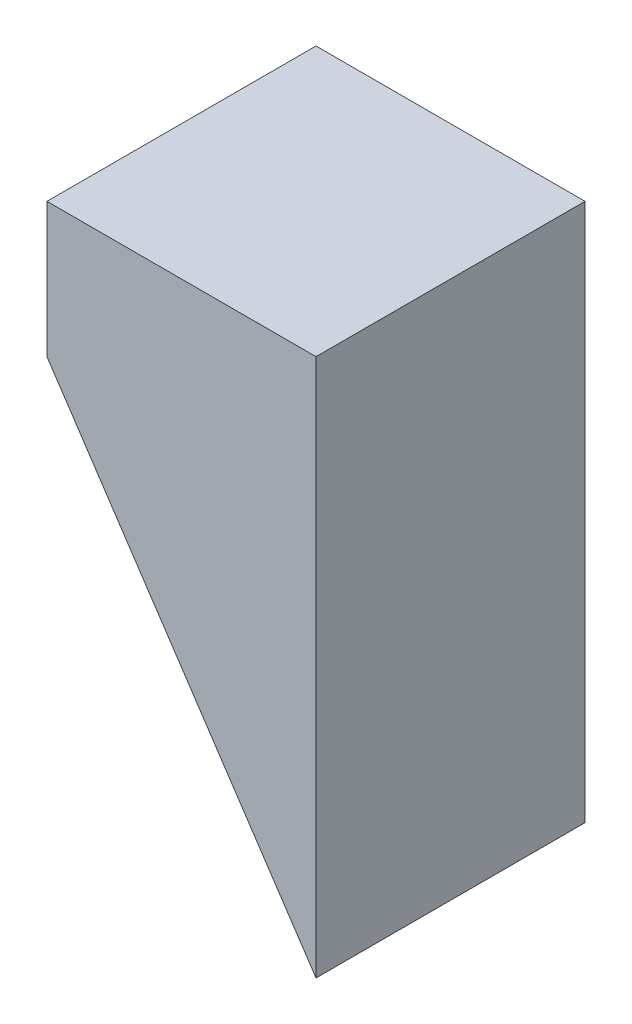
from build123d import *

# Parameters (mm, degrees)
EXTRUDE_1_DEPTH     = 30
SKETCH_2_W          = 20
SKETCH_2_H          = 30.268482551
CUT_EXTRUDE_1_DEPTH = 27


with BuildPart() as part:
    # 草圖1 → 填料-伸長1 (new body)
    with BuildSketch(Plane.XY):
        Polygon((-18.940316301, 5.568561873), (11.059683699, -39.431438127), (11.059683699, 20.568561873), (-18.940316301, 20.568561873), align=None)
    extrude(amount=EXTRUDE_1_DEPTH)

    # 草圖2 → 除料-伸長1 (cut)
    with BuildSketch(Plane.ZY.offset(18.940316301)):
        with Locations((15, -13.262891615)):
            Rectangle(SKETCH_2_W, SKETCH_2_H)
    extrude(amount=-CUT_EXTRUDE_1_DEPTH, mode=Mode.SUBTRACT)


solid = part.part
